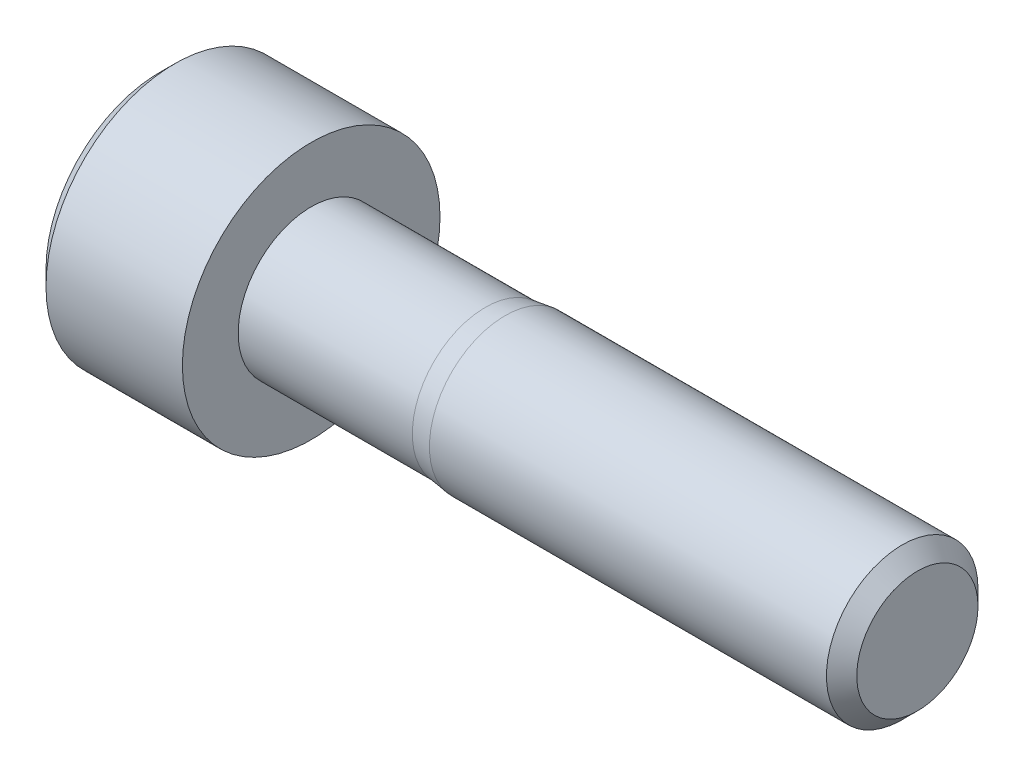
from build123d import *

# Parameters (mm, degrees)
SKETCH1_W           = 5
SKETCH1_H           = 4.25
SKETCH2_R           = 2.41
BOSS_EXTRUDE1_DEPTH = 5.746788991
SKETCH3_R           = 2.41
BOSS_EXTRUDE2_DEPTH = 0.653211009
BOSS_EXTRUDE2_DRAFT = -7.844871593
SKETCH4_R           = 2.5
BOSS_EXTRUDE3_DEPTH = 13.6
CUT_EXTRUDE1_DEPTH  = 2.5
CHAMFER1_SIZE       = 0.5


with BuildPart() as part:
    # Sketch1 → Revolve1 (revolve)
    with BuildSketch(Plane(origin=(0, 0, 0), x_dir=(-1, 0, 0), z_dir=(0, 0, -1)), mode=Mode.PRIVATE) as revolve1_sk:
        with Locations((2.5, 2.125)):
            Rectangle(SKETCH1_W, SKETCH1_H)
    revolve(revolve1_sk.sketch.rotate(Axis((0, 0, 0), (-1, 0, 0)), 270), axis=Axis((0, 0, 0), (-1, 0, 0)))

    # Sketch2 → Boss-Extrude1 (add)
    with BuildSketch(Plane(origin=(0, 0, 0), x_dir=(0, 0, -1), z_dir=(1, 0, 0))):
        Circle(SKETCH2_R)
    extrude(amount=BOSS_EXTRUDE1_DEPTH)


with BuildPart() as boss_extrude2_tool:
    # Sketch3 → Boss-Extrude2 (with draft: the straight prism first)
    with BuildSketch(Plane(origin=(5.746788991, 0, 0), x_dir=(0, 0, -1), z_dir=(1, 0, 0))):
        Circle(SKETCH3_R)
    extrude(amount=BOSS_EXTRUDE2_DEPTH)
    # Boss-Extrude2: the draft: its side faces are tilted about the plane it starts from
    boss_extrude2_sides = [boss_extrude2_tool.faces().sort_by_distance(p)[0] for p in [
        (6.073394495, 0, 2.41),
    ]]
    draft(boss_extrude2_sides, Plane(origin=(5.746788991, 0, 0), x_dir=(0, 0, -1), z_dir=(1, 0, 0)), BOSS_EXTRUDE2_DRAFT)


with BuildPart() as part_1:
    add(part.part)

    # Boss-Extrude2: add boss_extrude2_tool
    add(boss_extrude2_tool.part)

    # Sketch4 → Boss-Extrude3 (add)
    with BuildSketch(Plane(origin=(6.4, 0, 0), x_dir=(0, 0, -1), z_dir=(1, 0, 0))):
        Circle(SKETCH4_R)
    extrude(amount=BOSS_EXTRUDE3_DEPTH)

    # Sketch5 → Cut-Extrude1 (cut)
    with BuildSketch(Plane.ZY.offset(5)):
        Polygon((-2, -1.154700538), (0, -2.309401077), (2, -1.154700538), (2, 1.154700538), (0, 2.309401077), (-2, 1.154700538), align=None)
    extrude(amount=-CUT_EXTRUDE1_DEPTH, mode=Mode.SUBTRACT)

    # Sketch6 → Cut-Revolve1 (revolve, cut)
    with BuildSketch(Plane.XY, mode=Mode.PRIVATE) as cut_revolve1_sk:
        Polygon((-2.5, 2), (-2.5, 0), (-1.345299462, 0), align=None)
    revolve(cut_revolve1_sk.sketch.rotate(Axis((-2.500025, 0, 0), (1, 0, 0)), 90), axis=Axis((-2.500025, 0, 0), (1, 0, 0)), mode=Mode.SUBTRACT)

    # Chamfer1
    chamfer1_edges = [part_1.edges().sort_by_distance(p)[0] for p in [
        (20, 0, 2.5),
        (-5, 0, -4.25),
    ]]
    chamfer(chamfer1_edges, length=CHAMFER1_SIZE)


solid = part_1.part
